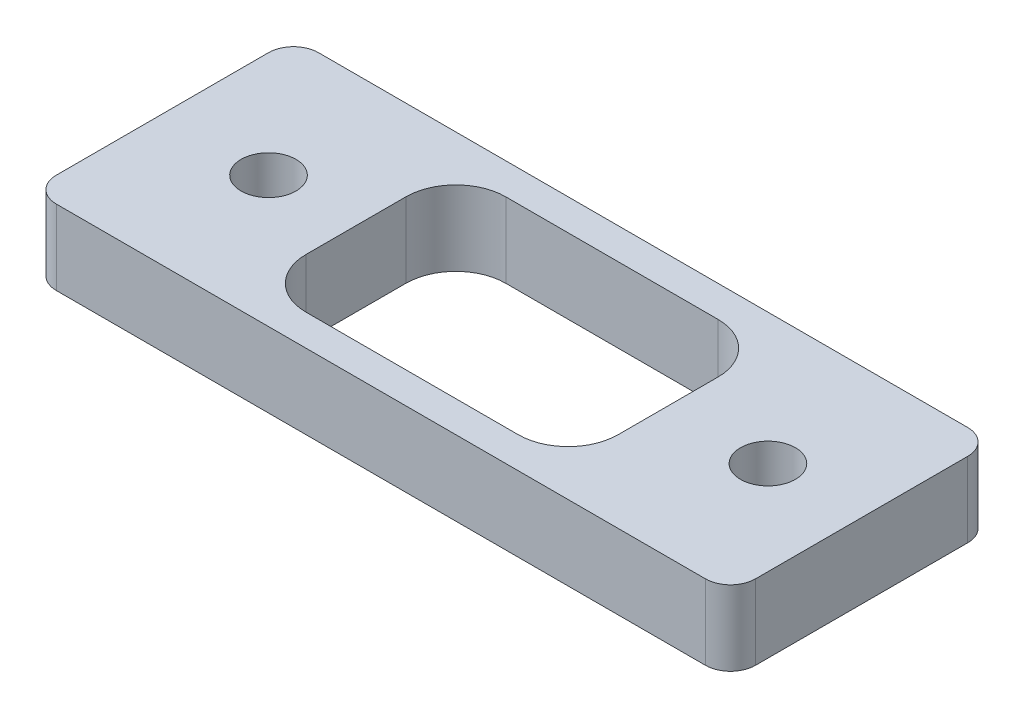
from build123d import *

# Parameters (mm, degrees)
SKETCH_1_W          = 28
SKETCH_1_H          = 12
EXTRUDE_1_DEPTH     = 21
SKETCH_2_R          = 1.75
CUT_EXTRUDE_1_DEPTH = 59
SKETCH_3_R          = 2.2
CUT_EXTRUDE_2_DEPTH = 65
SKETCH_7_W          = 15
SKETCH_7_H          = 15
CUT_EXTRUDE_3_DEPTH = 109
CUT_EXTRUDE_5_DEPTH = 84
FILLET_1_R          = 2
CUT_EXTRUDE_6_DEPTH = 6
SKETCH_15_W         = 25
SKETCH_15_H         = 16
CUT_EXTRUDE_7_DEPTH = 55
FILLET_2_R          = 4


with BuildPart() as part:
    # 草图1 → 凸台-拉伸1 (new body)
    with BuildSketch(Plane.XY):
        Polygon((56, -12), (28, -12), (0, -12), (-13, -12), (-13, -63), (69, -63), (69, -12), align=None)
        with Locations((42, -6)):
            Rectangle(SKETCH_1_W, SKETCH_1_H)
        with Locations((14, -6)):
            Rectangle(SKETCH_1_W, SKETCH_1_H)
    extrude(amount=EXTRUDE_1_DEPTH)

    # 草图2 → 切除-拉伸1 (cut)
    with BuildSketch(Plane(origin=(0, 0, 0), x_dir=(-1, 0, 0), z_dir=(0, 0, -1))):
        with Locations((-58, -54.25)):
            Circle(SKETCH_2_R)
        with Locations((2, -54.25)):
            Circle(SKETCH_2_R)
    extrude(amount=-CUT_EXTRUDE_1_DEPTH, mode=Mode.SUBTRACT)

    # 草图3 → 切除-拉伸2 (cut)
    with BuildSketch(Plane(origin=(0, 0, 0), x_dir=(1, 0, 0), z_dir=(0, 1, 0))):
        with Locations(Location((48.5, -10.5, 0), (0, 0, 180))):
            Circle(SKETCH_3_R)
        with Locations(Location((8.5, -10.5, 0), (0, 0, 180))):
            Circle(SKETCH_3_R)
    extrude(amount=-CUT_EXTRUDE_2_DEPTH, mode=Mode.SUBTRACT)

    # 草图7 → 切除-拉伸3 (cut)
    with BuildSketch(Plane(origin=(69, 0, 0), x_dir=(0, 0, -1), z_dir=(1, 0, 0))):
        with Locations((-10.5, -19.5)):
            Rectangle(SKETCH_7_W, SKETCH_7_H)
    extrude(amount=-CUT_EXTRUDE_3_DEPTH, mode=Mode.SUBTRACT)

    # 草图9 → 切除-拉伸5 (cut, symmetric)
    with BuildSketch(Plane(origin=(56, 0, 0), x_dir=(0, 0, -1), z_dir=(1, 0, 0))):
        Polygon((-18, -27), (-18, -12), (-21, -12), (-21, -63), (0, -63), (0, -12), (-3, -12), (-3, -27), align=None)
    extrude(amount=CUT_EXTRUDE_5_DEPTH, both=True, mode=Mode.SUBTRACT)

    # 圆角1
    fillet_1_edges = [part.edges().sort_by_distance(p)[0] for p in [
        (0, -6, 0),
        (56, -6, 0),
        (56, -6, 21),
        (0, -6, 21),
    ]]
    fillet(fillet_1_edges, radius=FILLET_1_R)

    # 草图14 → 切除-拉伸6 (cut)
    with BuildSketch(Plane(origin=(0, 0, 0), x_dir=(1, 0, 0), z_dir=(0, 1, 0))):
        with BuildLine():
            Line((56, -19), (56, -2))
            ThreePointArc((56, -2), (55.414213562, -0.585786438), (54, 0))
            Line((54, 0), (2, 0))
            ThreePointArc((2, 0), (0.585786438, -0.585786438), (0, -2))
            Line((0, -2), (0, -19))
            ThreePointArc((0, -19), (0.585786438, -20.414213562), (2, -21))
            Line((2, -21), (54, -21))
            ThreePointArc((54, -21), (55.414213562, -20.414213562), (56, -19))
        make_face()
    extrude(amount=-CUT_EXTRUDE_6_DEPTH, mode=Mode.SUBTRACT)

    # 草图15 → 切除-拉伸7 (cut)
    with BuildSketch(Plane(origin=(0, -6, 0), x_dir=(1, 0, 0), z_dir=(0, 1, 0))):
        with Locations((28, -10.5)):
            Rectangle(SKETCH_15_W, SKETCH_15_H)
    extrude(amount=-CUT_EXTRUDE_7_DEPTH, mode=Mode.SUBTRACT)

    # 圆角2
    fillet_2_edges = [part.edges().sort_by_distance(p)[0] for p in [
        (40.5, -9, 2.5),
        (40.5, -9, 18.5),
        (15.5, -9, 18.5),
        (15.5, -9, 2.5),
    ]]
    fillet(fillet_2_edges, radius=FILLET_2_R)


solid = part.part
